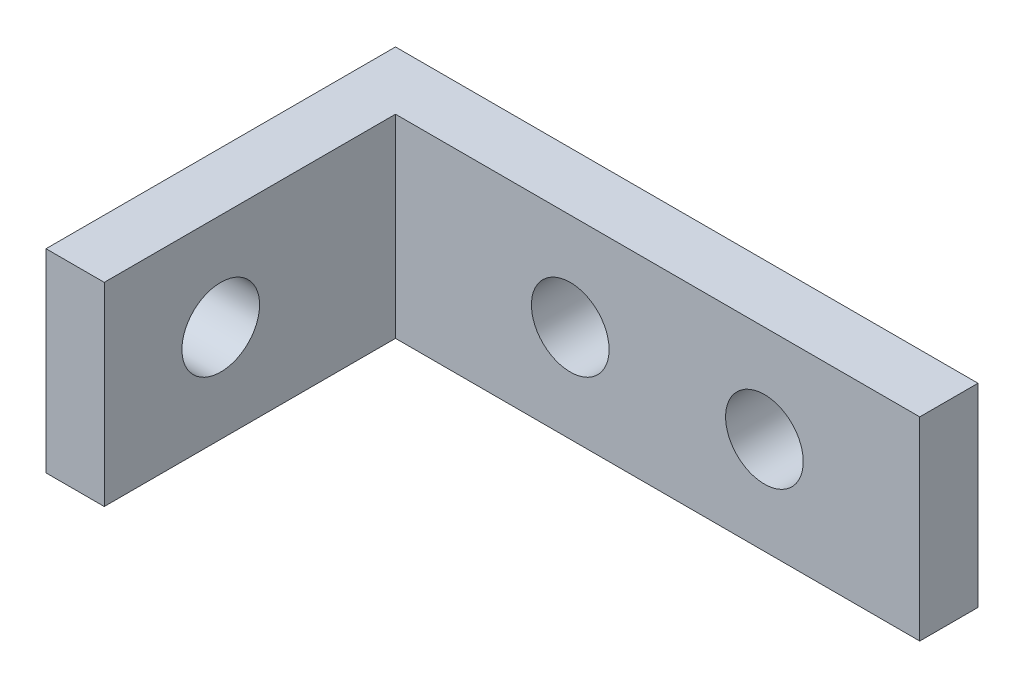
from build123d import *

# Parameters (mm, degrees)
SKETCH2_W           = 30
SKETCH2_H           = 10
SKETCH2_R           = 2
BOSS_EXTRUDE1_DEPTH = 3
SKETCH3_W           = 3
SKETCH3_H           = 10
BOSS_EXTRUDE2_DEPTH = 15
SKETCH4_R           = 2
CUT_EXTRUDE1_DEPTH  = 27


with BuildPart() as part:
    # Sketch2 → Boss-Extrude1 (new body)
    with BuildSketch(Plane.XY):
        with Locations((15, 5)):
            Rectangle(SKETCH2_W, SKETCH2_H)
        with Locations((12, 5)):
            Circle(SKETCH2_R, mode=Mode.SUBTRACT)
        with Locations((22, 5)):
            Circle(SKETCH2_R, mode=Mode.SUBTRACT)
    extrude(amount=BOSS_EXTRUDE1_DEPTH)

    # Sketch3 → Boss-Extrude2 (add)
    with BuildSketch(Plane.XY.offset(3)):
        with Locations((1.5, 5)):
            Rectangle(SKETCH3_W, SKETCH3_H)
    extrude(amount=BOSS_EXTRUDE2_DEPTH)

    # Sketch4 → Cut-Extrude1 (cut)
    with BuildSketch(Plane(origin=(3, 0, 0), x_dir=(0, 0, -1), z_dir=(1, 0, 0))):
        with Locations((-22, 5)):
            Circle(SKETCH4_R)
        with Locations(Location((-12, 5, 0), (0, 0, 90))):
            Circle(SKETCH4_R)
    extrude(amount=-CUT_EXTRUDE1_DEPTH, mode=Mode.SUBTRACT)


solid = part.part
